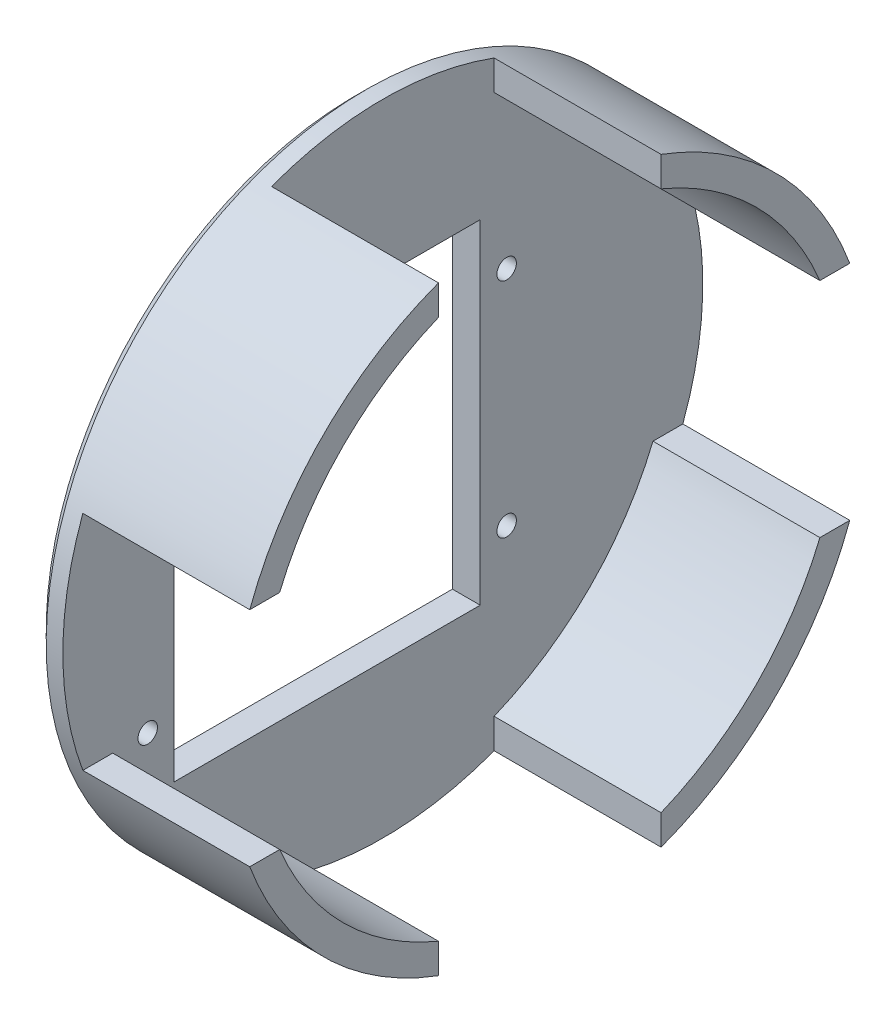
from build123d import *

# Parameters (mm, degrees)
SKETCH_1_R          = 57.5
EXTRUDE_1_DEPTH     = 5
SKETCH_2_R          = 57.5
SKETCH_2_R_2        = 52.5
EXTRUDE_2_DEPTH     = 30
SKETCH_3_R          = 1.75
SKETCH_3_W          = 55
SKETCH_3_H          = 60
CUT_EXTRUDE_1_DEPTH = 87.674679117
CUT_EXTRUDE_START   = -30
CUT_EXTRUDE_2_DEPTH = 30
CHAMFER_1_SIZE      = 2


with BuildPart() as part:
    # ｽｹｯﾁ1 → ﾎﾞｽ - 押し出し1 (new body)
    with BuildSketch(Plane(origin=(0, 0, 0), x_dir=(0, 0, -1), z_dir=(1, 0, 0))):
        Circle(SKETCH_1_R)
    extrude(amount=EXTRUDE_1_DEPTH)

    # ｽｹｯﾁ2 → ﾎﾞｽ - 押し出し2 (add)
    with BuildSketch(Plane(origin=(5, 0, 0), x_dir=(0, 0, -1), z_dir=(1, 0, 0))):
        Circle(SKETCH_2_R)
        Circle(SKETCH_2_R_2, mode=Mode.SUBTRACT)
    extrude(amount=EXTRUDE_2_DEPTH)

    # ｽｹｯﾁ3 → ｶｯﾄ - 押し出し1 (cut, through all)
    with BuildSketch(Plane(origin=(5, 0, 0), x_dir=(0, 0, -1), z_dir=(1, 0, 0))):
        with Locations((-42.25, 20)):
            Circle(SKETCH_3_R)
        with Locations(Location((-42.25, -20, 0), (0, 0, 180))):
            Circle(SKETCH_3_R)
        with Locations(Location((22.25, 20, 0), (0, 0, 180))):
            Circle(SKETCH_3_R)
        with Locations((22.25, -20)):
            Circle(SKETCH_3_R)
        with Locations((-10, 0)):
            Rectangle(SKETCH_3_W, SKETCH_3_H)
    extrude(amount=-CUT_EXTRUDE_1_DEPTH, mode=Mode.SUBTRACT)

    # ｽｹｯﾁ4 → ｶｯﾄ - 押し出し2 (cut)
    with BuildSketch(Plane(origin=(35, 0, 0), x_dir=(0, 0, -1), z_dir=(1, 0, 0)).offset(CUT_EXTRUDE_START)):
        with BuildLine():
            ThreePointArc((20, 53.909646632), (0, 57.5), (-20, 53.909646632))
            Line((-20, 53.909646632), (-20, 48.541219597))
            ThreePointArc((-20, 48.541219597), (0, 52.5), (20, 48.541219597))
            Line((20, 48.541219597), (20, 53.909646632))
        make_face()
        with BuildLine():
            Line((-48.541219597, 20), (-53.909646632, 20))
            ThreePointArc((-53.909646632, 20), (-57.5, 0), (-53.909646632, -20))
            Line((-53.909646632, -20), (-48.541219597, -20))
            ThreePointArc((-48.541219597, -20), (-52.5, 0), (-48.541219597, 20))
        make_face()
        with BuildLine():
            Line((53.909646632, 20), (48.541219597, 20))
            ThreePointArc((48.541219597, 20), (52.5, 0), (48.541219597, -20))
            Line((48.541219597, -20), (53.909646632, -20))
            ThreePointArc((53.909646632, -20), (57.5, 0), (53.909646632, 20))
        make_face()
        with BuildLine():
            Line((-20, -48.541219597), (-20, -53.909646632))
            ThreePointArc((-20, -53.909646632), (0, -57.5), (20, -53.909646632))
            Line((20, -53.909646632), (20, -48.541219597))
            ThreePointArc((20, -48.541219597), (0, -52.5), (-20, -48.541219597))
        make_face()
    extrude(amount=CUT_EXTRUDE_2_DEPTH, mode=Mode.SUBTRACT)

    # 面取り1
    chamfer_1_edges = [part.edges().sort_by_distance(p)[0] for p in [
        (0, 0, 57.5),
    ]]
    chamfer(chamfer_1_edges, length=CHAMFER_1_SIZE)


solid = part.part
